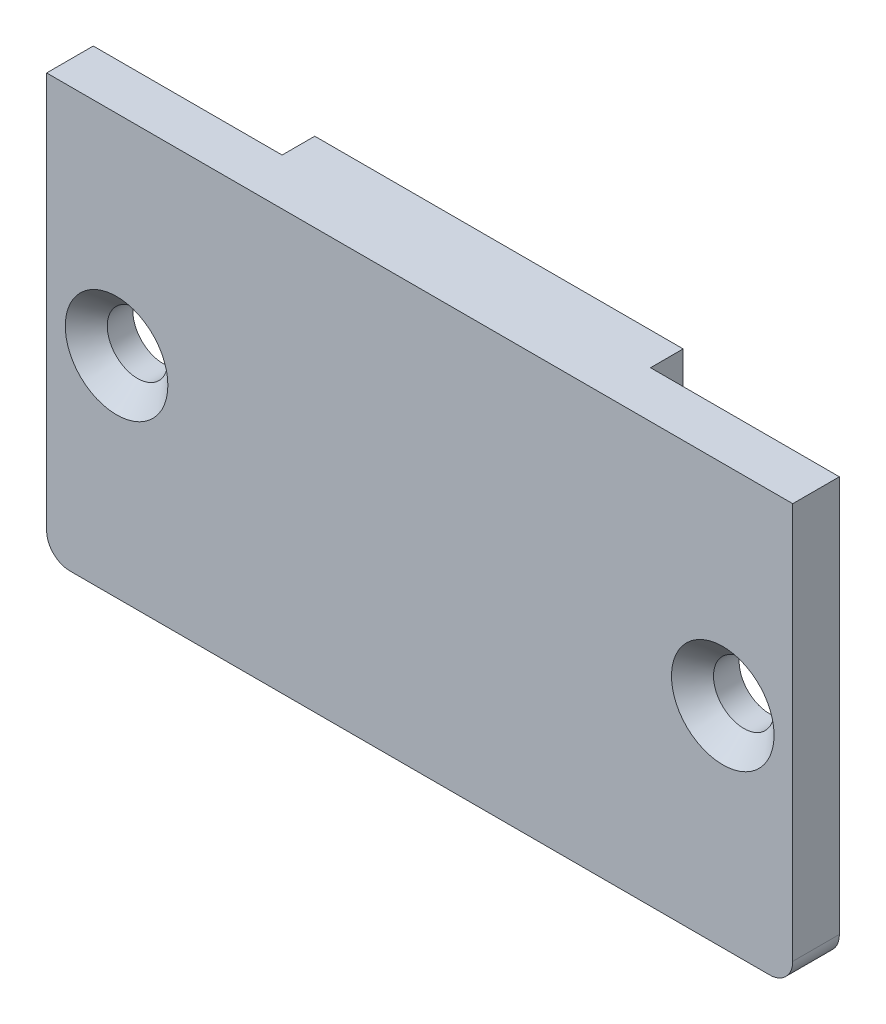
from build123d import *

# Parameters (mm, degrees)
ESQUISSE1_W                                    = 32
ESQUISSE1_H                                    = 18
BOSS_EXTRU_1_DEPTH                             = 2
ESQUISSE2_W                                    = 19
ESQUISSE2_H                                    = 14
BOSS_EXTRU_2_DEPTH                             = 1.4
FRAISAGE_POUR_VIS_T_TE_FRAIS_E_M21_D           = 2.6
FRAISAGE_POUR_VIS_T_TE_FRAIS_E_M21_CSINK_D     = 4.4
FRAISAGE_POUR_VIS_T_TE_FRAIS_E_M21_CSINK_ANGLE = 90
ESQUISSE6_W                                    = 15.8
ESQUISSE6_H                                    = 2
BOSS_EXTRU_3_DEPTH                             = 1.4
ESQUISSE7_W                                    = 19.2
ESQUISSE7_H                                    = 1.2
BOSS_EXTRU_4_DEPTH                             = 3.4
CONG_7_R                                       = 1


with BuildPart() as part:
    # Esquisse1 → Boss.-Extru.1 (new body)
    with BuildSketch(Plane.XY):
        Rectangle(ESQUISSE1_W, ESQUISSE1_H)
    extrude(amount=BOSS_EXTRU_1_DEPTH)

    # Esquisse2 → Boss.-Extru.2 (add)
    with BuildSketch(Plane(origin=(0, 0, 0), x_dir=(-1, 0, 0), z_dir=(0, 0, -1))):
        Rectangle(ESQUISSE2_W, ESQUISSE2_H)
    extrude(amount=BOSS_EXTRU_2_DEPTH)

    # Fraisage pour vis à tête fraisée M21 (through all)
    with Locations(Plane.XY.offset(2)):
        with Locations((-13, 0)):
            fraisage_pour_vis_t_te_frais_e_m21 = CounterSinkHole(FRAISAGE_POUR_VIS_T_TE_FRAIS_E_M21_D / 2, FRAISAGE_POUR_VIS_T_TE_FRAIS_E_M21_CSINK_D / 2, counter_sink_angle=FRAISAGE_POUR_VIS_T_TE_FRAIS_E_M21_CSINK_ANGLE)

    # Symétrie1: Fraisage pour vis à tête fraisée M21 across plane
    add(fraisage_pour_vis_t_te_frais_e_m21.mirror(Plane(origin=(0, 0, 0), x_dir=(0, 0, 1), z_dir=(1, 0, 0))), mode=Mode.SUBTRACT)

    # Esquisse6 → Boss.-Extru.3 (add)
    with BuildSketch(Plane(origin=(0, 0, 0), x_dir=(-1, 0, 0), z_dir=(0, 0, -1))):
        with Locations((0, 8)):
            Rectangle(ESQUISSE6_W, ESQUISSE6_H)
    extrude(amount=BOSS_EXTRU_3_DEPTH)

    # Esquisse7 → Boss.-Extru.4 (add)
    with BuildSketch(Plane.XY.offset(2)):
        with Locations((0, 6.4)):
            Rectangle(ESQUISSE7_W, ESQUISSE7_H)
    extrude(amount=-BOSS_EXTRU_4_DEPTH)

    # Congé7
    cong_7_edges = [part.edges().sort_by_distance(p)[0] for p in [
        (16, -9, 1),
        (-16, -9, 1),
    ]]
    fillet(cong_7_edges, radius=CONG_7_R)


solid = part.part
